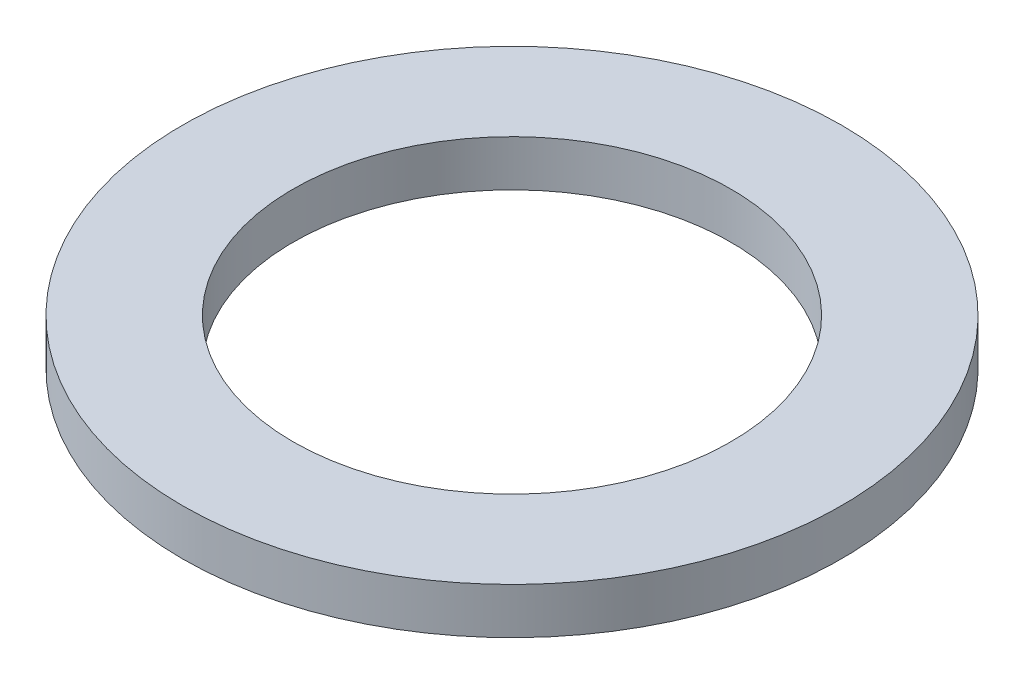
from build123d import *

# Parameters (mm, degrees)
SKETCH_1_R      = 7.15
SKETCH_1_R_2    = 4.75
EXTRUDE_1_DEPTH = 1


with BuildPart() as part:
    # 草图1 → 凸台-拉伸1 (new body)
    with BuildSketch(Plane(origin=(0, 0, 0), x_dir=(1, 0, 0), z_dir=(0, 1, 0))):
        with Locations(Location((0, 0, 0), (0, 0, 270))):
            Circle(SKETCH_1_R)
        with Locations(Location((0, 0, 0), (0, 0, 270))):
            Circle(SKETCH_1_R_2, mode=Mode.SUBTRACT)
    extrude(amount=EXTRUDE_1_DEPTH)


solid = part.part
